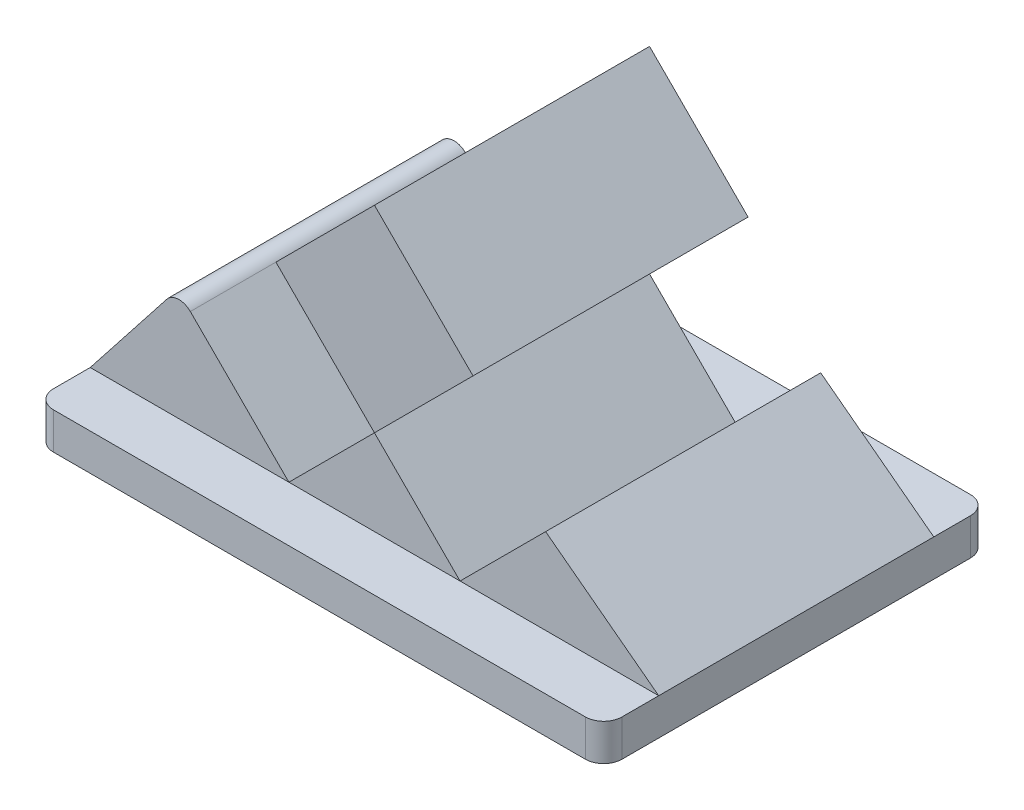
from build123d import *

# Parameters (mm, degrees)
BOSS_EXTRUDE1_DEPTH = 20
BOSS_EXTRUDE2_DEPTH = 75


with BuildPart() as part:
    # Sketch2 → Boss-Extrude1 (new body)
    with BuildSketch(Plane(origin=(0, 0, 0), x_dir=(1, 0, 0), z_dir=(0, 1, 0))):
        with BuildLine():
            Line((-145, 105), (145, 105))
            ThreePointArc((145, 105), (152.071067812, 102.071067812), (155, 95))
            Line((155, 95), (155, -95))
            ThreePointArc((155, -95), (152.071067812, -102.071067812), (145, -105))
            Line((145, -105), (-145, -105))
            ThreePointArc((-145, -105), (-152.071067812, -102.071067812), (-155, -95))
            Line((-155, -95), (-155, 95))
            ThreePointArc((-155, 95), (-152.071067812, 102.071067812), (-145, 105))
        make_face()
    extrude(amount=BOSS_EXTRUDE1_DEPTH)

    # Sketch4 → Boss-Extrude2 (add, symmetric)
    with BuildSketch(Plane.XY):
        with BuildLine():
            Line((-155, 20), (-46.669047558, 20))
            Line((-46.669047558, 20), (-100.409162928, 73.74011537))
            ThreePointArc((-100.409162928, 73.74011537), (-106.583385641, 76.297562155), (-112.757608353, 73.74011537))
            Line((-112.757608353, 73.74011537), (-155, 20))
        make_face()
        Polygon((46.669047558, 20), (0, 66.669047558), (-46.669047558, 20), align=None)
        Polygon((93.338095117, 66.669047558), (46.669047558, 20), (155, 20), align=None)
        Polygon((0, 174.149278299), (53.74011537, 120.409162928), (0, 66.669047558), (-53.74011537, 120.409162928), align=None)
    extrude(amount=BOSS_EXTRUDE2_DEPTH, both=True)


with BuildPart() as boss_extrude2_piece_1:
    # of the separate pieces the step leaves, piece 1, a body of its own (boss_extrude2_pieces)
    add(part.part.solids().sort_by_distance((-145, 0, -105))[0])


with BuildPart() as boss_extrude2_piece_2:
    # of the separate pieces the step leaves, piece 2, a body of its own (boss_extrude2_pieces)
    add(part.part.solids().sort_by_distance((-53.74011537, 120.409162928, -75))[0])


solid = Compound([boss_extrude2_piece_1.part, boss_extrude2_piece_2.part])
